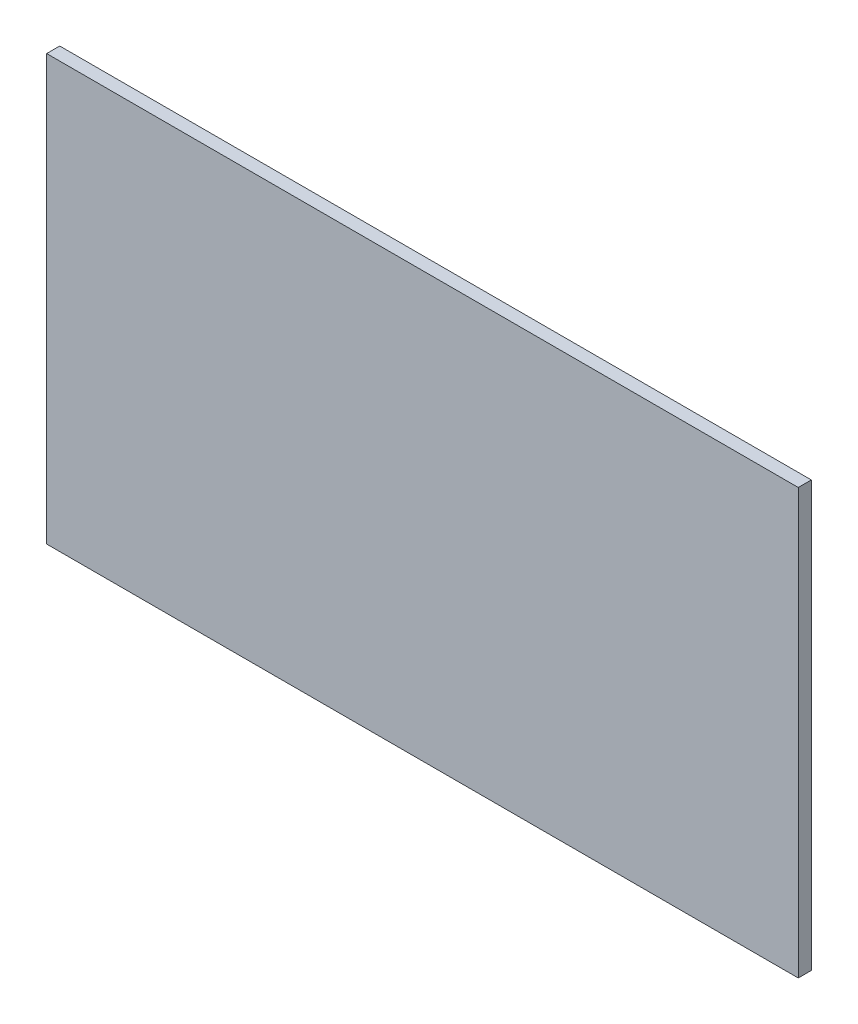
from build123d import *

# Parameters (mm, degrees)
CROQUIS1_W              = 230
CROQUIS1_H              = 130
SALIENTE_EXTRUIR1_DEPTH = 4


with BuildPart() as part:
    # Croquis1 → Saliente-Extruir1 (new body)
    with BuildSketch(Plane.XY):
        with Locations((115, -65)):
            Rectangle(CROQUIS1_W, CROQUIS1_H)
    extrude(amount=SALIENTE_EXTRUIR1_DEPTH)


solid = part.part
